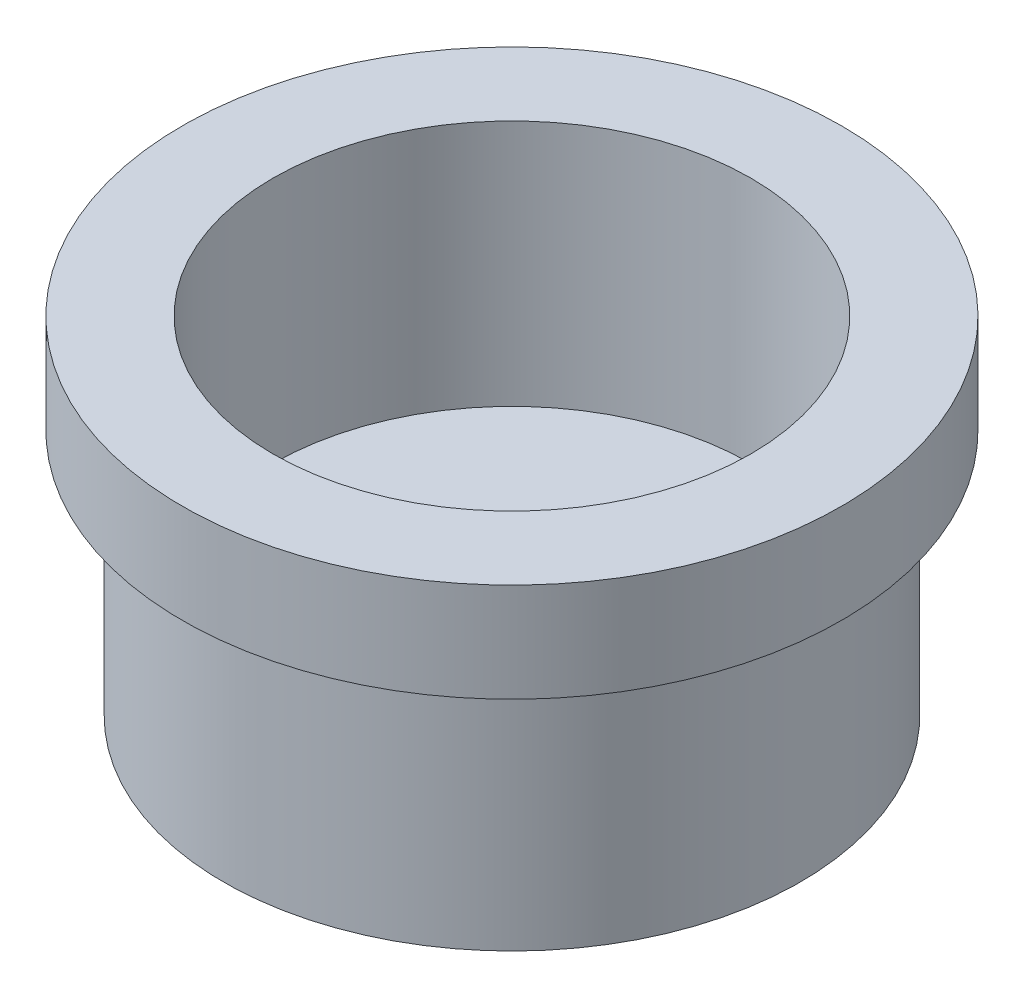
from build123d import *


with BuildPart() as part:
    # 草图1 → 旋转1 (revolve)
    with BuildSketch(Plane.XY, mode=Mode.PRIVATE) as revolve_1_sk:
        Polygon((-2.5, 0), (-2.5, 9), (-4.75, 9), (-4.75, 13), (-14.5, 13), (-14.5, 28), (-20, 28), (-20, 22), (-17.5, 22), (-17.5, 7), (-6.5, 7), (-6.5, 6), (-4.5, 6), (-4.5, 0), align=None)
    revolve(revolve_1_sk.sketch.rotate(Axis((0, 0, 0), (0, 1, 0)), 270), axis=Axis((0, 0, 0), (0, 1, 0)))


solid = part.part
